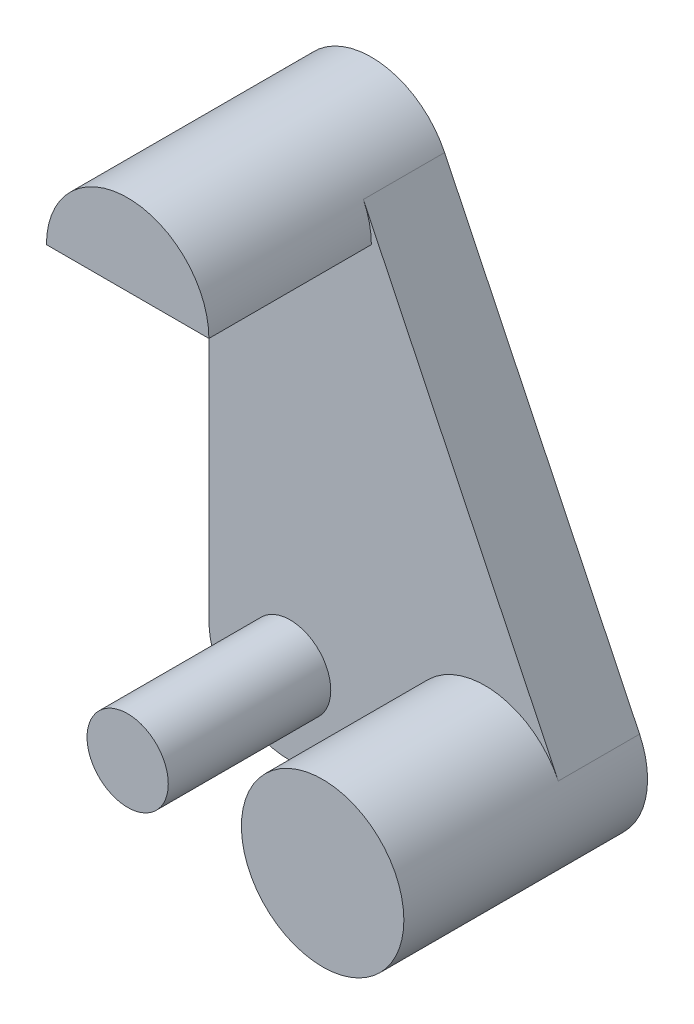
from build123d import *

# Parameters (mm, degrees)
SALIENTE_EXTRUIR1_DEPTH = 5
CROQUIS2_R              = 2.5
CROQUIS2_R_2            = 5
SALIENTE_EXTRUIR2_DEPTH = 10


with BuildPart() as part:
    # Croquis1 → Saliente-Extruir1 (new body)
    with BuildSketch(Plane.XY):
        with BuildLine():
            ThreePointArc((4.507615287, 27.163655338), (-0.972917939, 29.9044297), (-4.992202808, 25.279125636))
            Line((-4.992202808, 25.279125636), (-4.992202808, 24.720874364))
            Line((-4.992202808, 24.720874364), (-4.992202808, 0.279125636))
            ThreePointArc((-4.992202808, 0.279125636), (-3.632879586, -3.435430964), (0, -5))
            Line((0, -5), (12, -5))
            ThreePointArc((12, -5), (16.231918991, -2.662867187), (16.507615287, 2.163655338))
            Line((16.507615287, 2.163655338), (4.507615287, 27.163655338))
        make_face()
    extrude(amount=SALIENTE_EXTRUIR1_DEPTH)

    # Croquis2 → Saliente-Extruir2 (add)
    with BuildSketch(Plane.XY.offset(5)):
        Circle(CROQUIS2_R)
        with Locations(Location((12, 0, 0), (0, 0, 270))):
            Circle(CROQUIS2_R_2)
        with BuildLine():
            Line((-5, 25), (5, 25))
            ThreePointArc((5, 25), (0, 30), (-5, 25))
        make_face()
    extrude(amount=SALIENTE_EXTRUIR2_DEPTH)


solid = part.part
